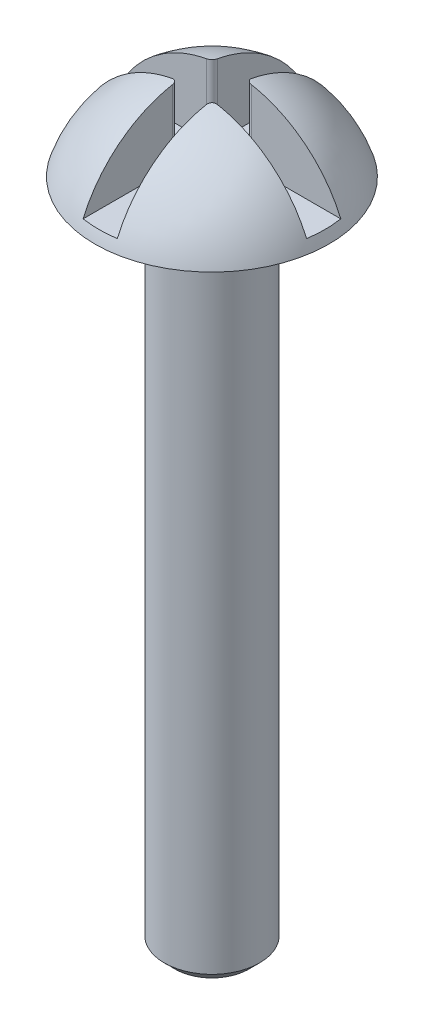
from build123d import *

# Parameters (mm, degrees)
SKETCH3_R        = 1.1303
SHAFT_DEPTH      = 15.875
TIP_SIZE         = 0.254
PHILLIPS_START   = 0.254
PHILLIPS_DEPTH   = 17.101026273
PHILLIPSFILLET_R = 0.127


with BuildPart() as part:
    # Sketch2 → Head (revolve)
    with BuildSketch(Plane(origin=(0, 0, 0), x_dir=(0, 0, -1), z_dir=(1, 0, 0))):
        with BuildLine():
            Line((0, 0), (2.7813, 0))
            ThreePointArc((2.7813, 0), (1.72225533, 1.469884796), (0, 2.032))
            Line((0, 2.032), (0, 0))
        make_face()
    revolve(axis=Axis((0, 0.415157056, 0), (0, -1, 0)))

    # Sketch3 → Shaft (add)
    with BuildSketch(Plane.XZ):
        with Locations(Location((0, 0, 0), (0, 0, 90))):
            Circle(SKETCH3_R)
    extrude(amount=SHAFT_DEPTH)

    # Tip
    tip_edges = [part.edges().sort_by_distance(p)[0] for p in [
        (0, -15.875, -1.1303),
    ]]
    chamfer(tip_edges, length=TIP_SIZE)

    # Sketch4 → Phillips (cut, through all)
    with BuildSketch(Plane(origin=(0, 0, 0), x_dir=(1, 0, 0), z_dir=(0, 1, 0)).offset(PHILLIPS_START)):
        Polygon((-0.4064, 0.4064), (-0.4064, 2.7813), (0.4064, 2.7813), (0.4064, 0.4064), (2.7813, 0.4064), (2.7813, -0.4064), (0.4064, -0.4064), (0.4064, -2.7813), (-0.4064, -2.7813), (-0.4064, -0.4064), (-2.7813, -0.4064), (-2.7813, 0.4064), align=None)
    extrude(amount=PHILLIPS_DEPTH, mode=Mode.SUBTRACT)

    # PhillipsFillet
    phillipsfillet_edges = [part.edges().sort_by_distance(p)[0] for p in [
        (0.4064, 1.114434201, -0.4064),
        (-0.4064, 1.114434201, -0.4064),
        (-0.4064, 1.114434201, 0.4064),
        (0.4064, 1.114434201, 0.4064),
    ]]
    fillet(phillipsfillet_edges, radius=PHILLIPSFILLET_R)


solid = part.part
